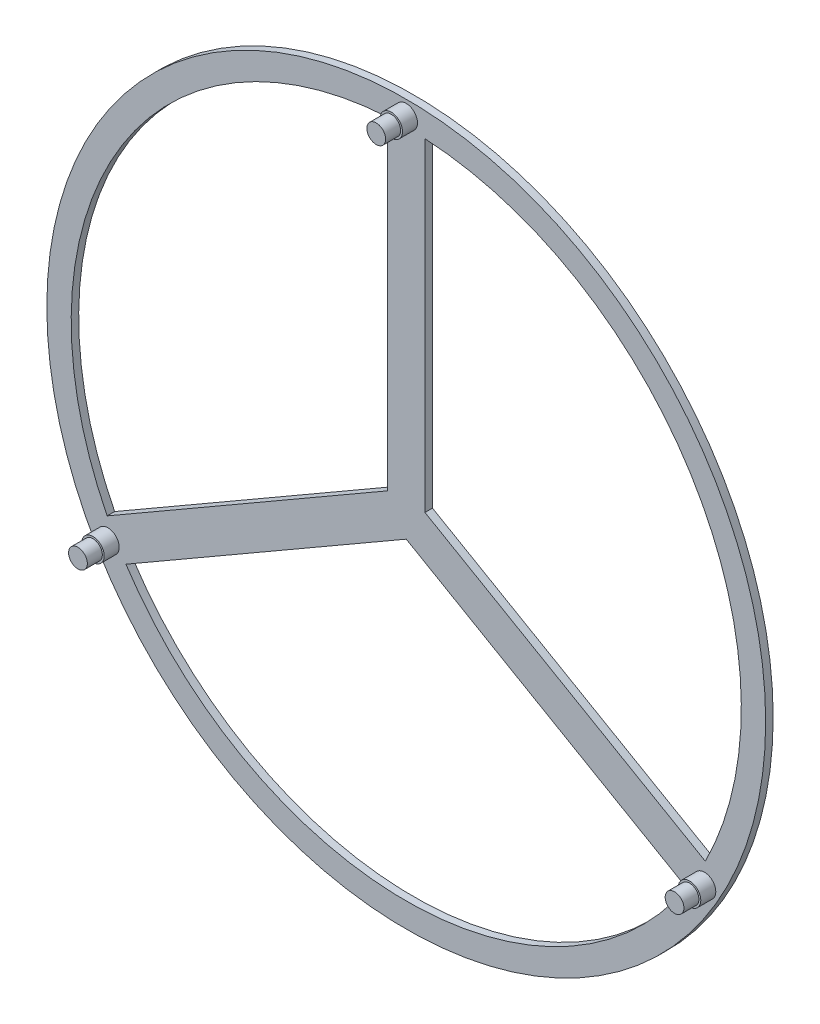
from build123d import *

# Parameters (mm, degrees)
SKETCH1_R                = 1917.013086508
BOSS_EXTRUDE1_DEPTH      = 40
SKETCH1_4_R              = 50
BOSS_EXTRUDE2_DEPTH      = 160
BOSS_EXTRUDE3_DEPTH      = 80
BOSS_EXTRUDE3_DEPTH_BACK = 10
SKETCH1_5_R              = 60


with BuildPart() as part:
    # Sketch1 → Boss-Extrude1 (new body)
    with BuildSketch(Plane.XY):
        with Locations((-6.034074555, 0)):
            Circle(SKETCH1_R)
        with BuildLine():
            ThreePointArc((93.965925445, 1784.212927694), (1541.564655256, 893.506543254), (1589.139646589, -805.503923468))
            Line((1589.139646589, -805.503923468), (93.965925445, 57.735026919))
            Line((93.965925445, 57.735026919), (93.965925445, 1784.212927694))
        make_face(mode=Mode.SUBTRACT)
        with BuildLine():
            Line((-106.034074555, 1784.212927694), (-106.034074555, 57.735026919))
            Line((-106.034074555, 57.735026919), (-1601.207795698, -805.503923468))
            ThreePointArc((-1601.207795698, -805.503923468), (-1553.632804365, 893.506543254), (-106.034074555, 1784.212927694))
        make_face(mode=Mode.SUBTRACT)
        with BuildLine():
            Line((-1501.207795698, -978.709004225), (-6.034074555, -115.470053838))
            Line((-6.034074555, -115.470053838), (1489.139646589, -978.709004225))
            ThreePointArc((1489.139646589, -978.709004225), (-6.034074555, -1787.013086508), (-1501.207795698, -978.709004225))
        make_face(mode=Mode.SUBTRACT)
    extrude(amount=-BOSS_EXTRUDE1_DEPTH)

    # Sketch1<4> → Boss-Extrude2 (add)
    with BuildSketch(Plane.XY):
        with Locations((1584.865925445, -918.506543254)):
            Circle(SKETCH1_4_R)
        with Locations((-1596.934074555, -918.506543254)):
            Circle(SKETCH1_4_R)
        with Locations((-6.034074555, 1837.013086508)):
            Circle(SKETCH1_4_R)
    extrude(amount=BOSS_EXTRUDE2_DEPTH)

    # Sketch1<5> → Boss-Extrude3 (add, two sides: drawn at the far end of the back side and taken through both)
    with BuildSketch(Plane.XY.offset(-BOSS_EXTRUDE3_DEPTH_BACK)):
        with Locations((-1596.934074555, -918.506543254)):
            Circle(SKETCH1_5_R)
        with Locations((-6.034074555, 1837.013086508)):
            Circle(SKETCH1_5_R)
        with Locations((1584.865925445, -918.506543254)):
            Circle(SKETCH1_5_R)
    extrude(amount=BOSS_EXTRUDE3_DEPTH + BOSS_EXTRUDE3_DEPTH_BACK)


solid = part.part
